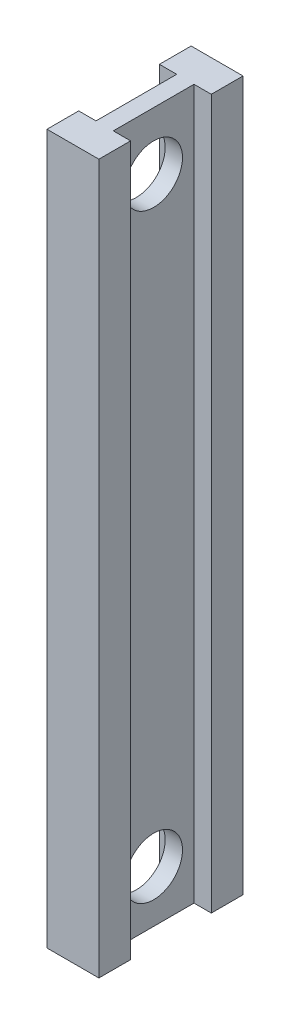
from build123d import *

# Parameters (mm, degrees)
BOSS_EXTRUDE1_DEPTH = 1230
SKETCH2_R           = 50
CUT_EXTRUDE1_DEPTH  = 1200
SKETCH3_R           = 50
CUT_EXTRUDE2_DEPTH  = 1200
SCALE1_SCALE        = 0.75


with BuildPart() as part:
    # Sketch1 → Boss-Extrude1 (new body)
    with BuildSketch(Plane(origin=(0, 0, 0), x_dir=(1, 0, 0), z_dir=(0, 1, 0))):
        Polygon((-45, -70), (-45, -125), (45, -125), (45, -70), (15, -70), (15, 70), (45, 70), (45, 125), (-45, 125), (-45, 70), (-15, 70), (-15, -70), align=None)
    extrude(amount=BOSS_EXTRUDE1_DEPTH)

    # Sketch2 → Cut-Extrude1 (cut)
    with BuildSketch(Plane(origin=(15, 0, 0), x_dir=(0, 0, -1), z_dir=(1, 0, 0))):
        with Locations((0, 90)):
            Circle(SKETCH2_R)
    extrude(amount=-CUT_EXTRUDE1_DEPTH, mode=Mode.SUBTRACT)

    # Sketch3 → Cut-Extrude2 (cut)
    with BuildSketch(Plane(origin=(15, 0, 0), x_dir=(0, 0, -1), z_dir=(1, 0, 0))):
        with Locations((0, 1130)):
            Circle(SKETCH3_R)
    extrude(amount=-CUT_EXTRUDE2_DEPTH, mode=Mode.SUBTRACT)


with BuildPart() as part_1:
    # Scale1: scaled about (0, 615.139653144, 0)
    add(part.part.scale(SCALE1_SCALE).moved(Location((0, 153.784913286, 0))))


solid = part_1.part
